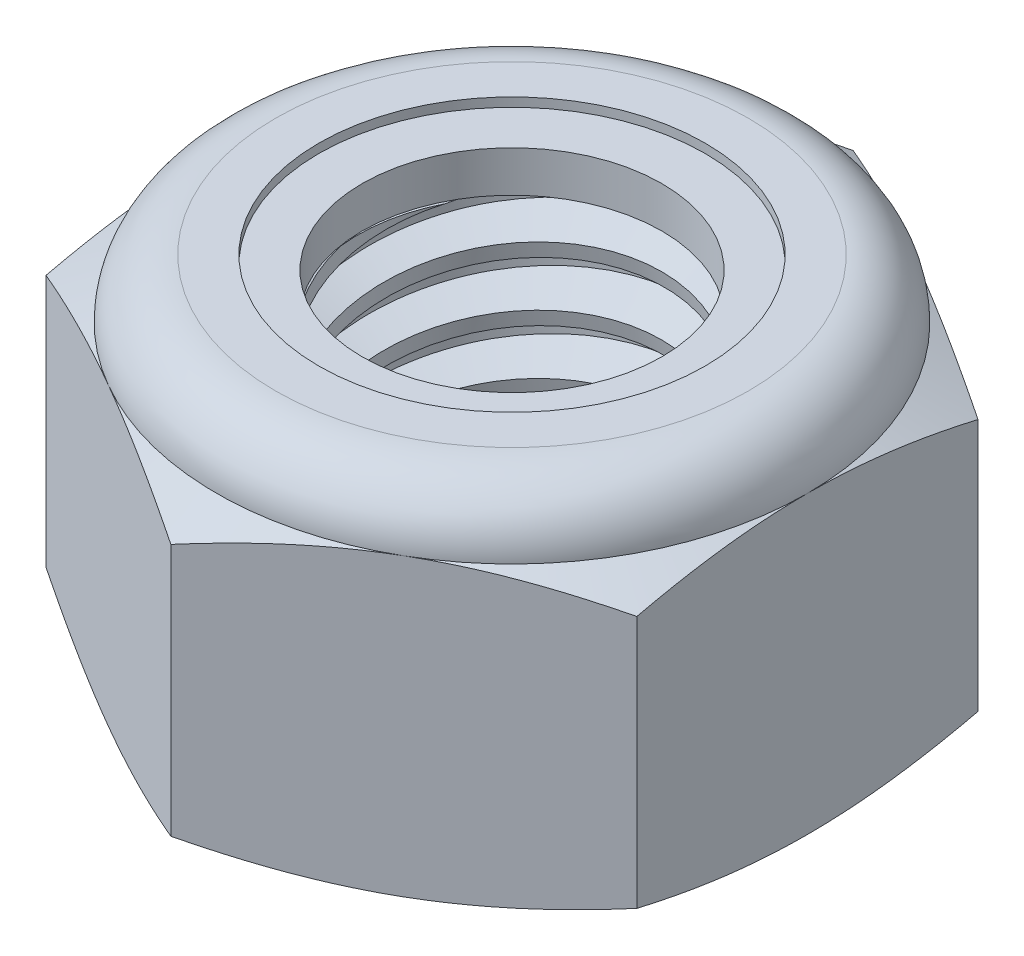
from build123d import *

# Parameters (mm, degrees)
EXTRUDE1_DEPTH      = 6
SKETCH2_W           = 3
SKETCH2_H           = 6
LPATTERN1_COUNT     = 6
LPATTERN1_PITCH     = 1
LPATTERN1_COL_COUNT = 2
LPATTERN1_COL_PITCH = 1


with BuildPart() as part:
    # Sketch1 → Extrude1 (new body)
    with BuildSketch(Plane(origin=(0, 0, 0), x_dir=(1, 0, 0), z_dir=(0, 1, 0))):
        Polygon((0, 5.773502692), (-5, 2.886751346), (-5, -2.886751346), (0, -5.773502692), (5, -2.886751346), (5, 2.886751346), align=None)
    extrude(amount=EXTRUDE1_DEPTH)

    # Sketch4 → Cut-Revolve2 (revolve, cut)
    with BuildSketch(Plane(origin=(0, 0, 0), x_dir=(0, 0, -1), z_dir=(1, 0, 0)), mode=Mode.PRIVATE) as cut_revolve2_sk:
        Polygon((0, 6), (3, 6), (2.538023184, 5.784576673), (2.538023184, 0.215423327), (3, 0), (0, 0), align=None)
    revolve(cut_revolve2_sk.sketch.rotate(Axis((0, 6, 0), (0, 1, 0)), 55.157981045), axis=Axis((0, 6, 0), (0, 1, 0)), mode=Mode.SUBTRACT)


with BuildPart() as body_2:
    # Sketch2 → Revolve1 (revolve)
    with BuildSketch(Plane(origin=(0, 0, 0), x_dir=(0, 0, -1), z_dir=(1, 0, 0))):
        with Locations((1.5, 3)):
            Rectangle(SKETCH2_W, SKETCH2_H)
    revolve(axis=Axis((0, -3, 0), (0, 1, 0)))

    # Sketch3 → Cut-Revolve1 (revolve, cut)
    with BuildSketch(Plane(origin=(0, 0, 0), x_dir=(0, 0, -1), z_dir=(1, 0, 0)), mode=Mode.PRIVATE) as cut_revolve1_sk:
        Polygon((3.020549873, 5.87670076), (3.164398987, 5.013606076), (2.579122931, 5.232870615), (2.538023184, 5.479469096), align=None)
    cut_revolve1 = revolve(cut_revolve1_sk.sketch.rotate(Axis((0, 6, 0.178376498), (0, -0.9863939238321437, -0.16439898730535746)), 180), axis=Axis((0, 6, 0.178376498), (0, -0.9863939238321437, -0.16439898730535746)), mode=Mode.SUBTRACT)

    # LPattern1: Cut-Revolve1 ×6
    with Locations(*[(0, -i * LPATTERN1_PITCH, 0) for i in range(1, LPATTERN1_COUNT)]):
        add(cut_revolve1, mode=Mode.SUBTRACT)

    # LPattern1 col: Cut-Revolve1 ×2
    with Locations(*[(0, i * LPATTERN1_COL_PITCH, 0) for i in range(1, LPATTERN1_COL_COUNT)]):
        add(cut_revolve1, mode=Mode.SUBTRACT)


with BuildPart() as part_1:
    add(part.part)

    # Combine1: cut body 2
    add(body_2.part, mode=Mode.SUBTRACT)

    # Sketch5 → Cut-Revolve3 (revolve, cut)
    with BuildSketch(Plane(origin=(0, 0, 0), x_dir=(0, 0, -1), z_dir=(1, 0, 0)), mode=Mode.PRIVATE) as cut_revolve3_sk:
        with BuildLine():
            Line((0, 0), (5, 0))
            Line((5, 0), (5.773502692, 0.360690229))
            Line((5.773502692, 0.360690229), (5.773502692, 4.639309771))
            Line((5.773502692, 4.639309771), (5, 5))
            ThreePointArc((5, 5), (4.707106781, 5.707106781), (4, 6))
            Line((4, 6), (4, 7.27))
            Line((4, 7.27), (7.043502692, 7.27))
            Line((7.043502692, 7.27), (7.043502692, -1.27))
            Line((7.043502692, -1.27), (0, -1.27))
            Line((0, -1.27), (0, 0))
        make_face()
    revolve(cut_revolve3_sk.sketch.rotate(Axis((0, 0, 0), (0, 1, 0)), 55.157981045), axis=Axis((0, 0, 0), (0, 1, 0)), mode=Mode.SUBTRACT)

    # Sketch6 → Cut-Revolve4 (revolve, cut)
    with BuildSketch(Plane(origin=(0, 0, 0), x_dir=(0, 0, -1), z_dir=(1, 0, 0)), mode=Mode.PRIVATE) as cut_revolve4_sk:
        with BuildLine():
            Line((0, 5), (4.8476, 5))
            ThreePointArc((4.8476, 5), (4.599343708, 5.599343708), (4, 5.8476))
            Line((4, 5.8476), (3.269011592, 5.8476))
            Line((3.269011592, 5.8476), (3.269011592, 7.27))
            Line((3.269011592, 7.27), (0, 7.27))
            Line((0, 7.27), (0, 5))
        make_face()
    revolve(cut_revolve4_sk.sketch.rotate(Axis((0, 7.27, 0), (0, 1, 0)), 32.153394979), axis=Axis((0, 7.27, 0), (0, 1, 0)), mode=Mode.SUBTRACT)


with BuildPart() as body_2_2:
    # Sketch7 → Revolve2 (revolve)
    with BuildSketch(Plane(origin=(0, 0, 0), x_dir=(0, 0, -1), z_dir=(1, 0, 0))):
        with BuildLine():
            Line((2.538023184, 5.0762), (4.767627201, 5.0762))
            ThreePointArc((4.767627201, 5.0762), (4.51782105, 5.57176859), (4, 5.7714))
            Line((4, 5.7714), (2.538023184, 5.7714))
            Line((2.538023184, 5.7714), (2.538023184, 5.0762))
        make_face()
    revolve(axis=Axis((0, 5.0762, 0), (0, 1, 0)))


solid = Compound([part_1.part, body_2_2.part])
